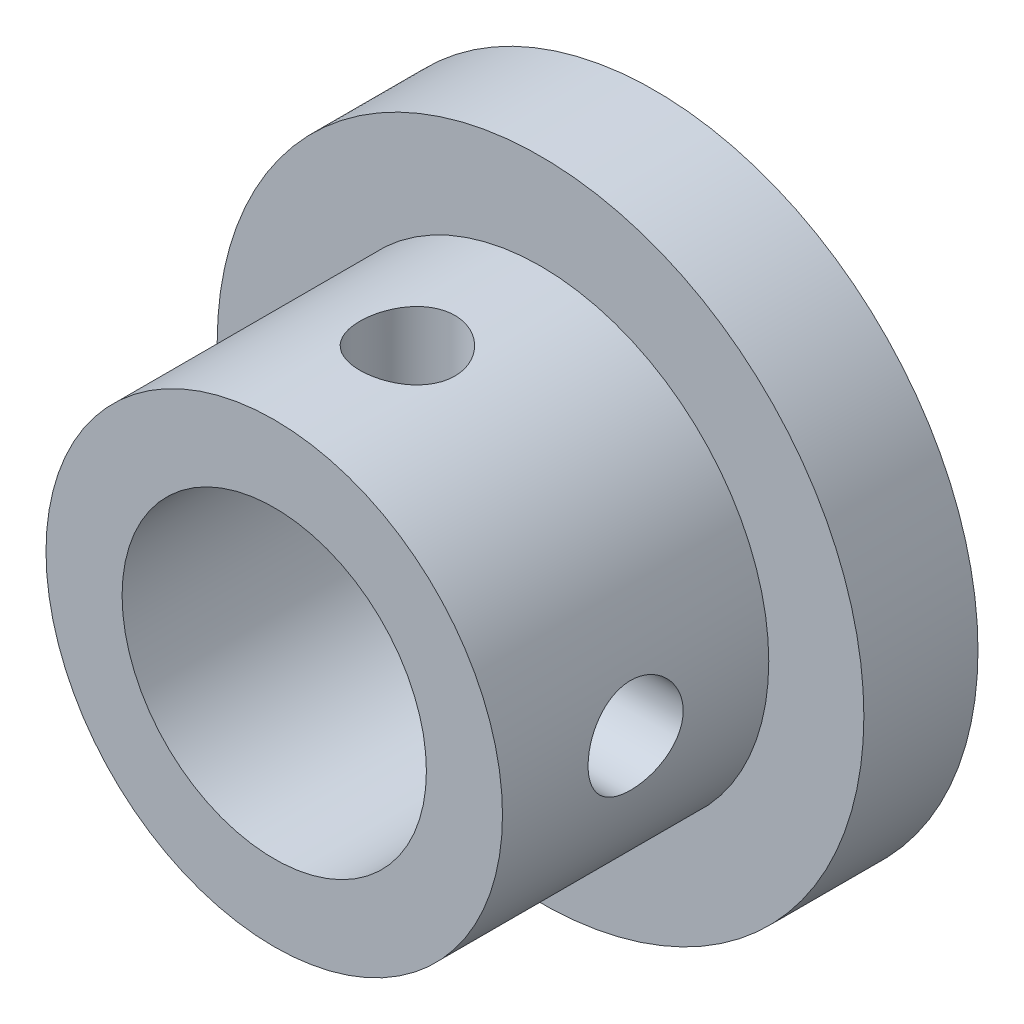
from build123d import *

# Parameters (mm, degrees)
SKETCH_1_R                       = 8.5
EXTRUDE_1_DEPTH                  = 3
SKETCH_2_R                       = 6
EXTRUDE_2_DEPTH                  = 7
CUT_EXTRUDE_1_REACH              = 17.636
SKETCH_3_R                       = 4
HOLE_WIZARD_M3_1_REACH           = 20.021
HOLE_WIZARD_M3_1_BORE_R          = 1.25
HOLE_WIZARD_M3_1_ON_FACE_2_REACH = 20.021
HOLE_WIZARD_M3_1_BORE_2_R        = 1.25


with BuildPart() as part:
    # 스케치1 → 보스-돌출1 (new body)
    with BuildSketch(Plane.XY):
        Circle(SKETCH_1_R)
    extrude(amount=EXTRUDE_1_DEPTH)

    # 스케치2 → 보스-돌출2 (add)
    with BuildSketch(Plane.XY.offset(3)):
        Circle(SKETCH_2_R)
    extrude(amount=EXTRUDE_2_DEPTH)

    # 스케치3 → 컷-돌출1 (cut, up to next)
    with BuildSketch(Plane(origin=(0, 0, 0), x_dir=(-1, 0, 0), z_dir=(0, 0, -1)), mode=Mode.PRIVATE) as cut_extrude_1_sk1:
        Circle(SKETCH_3_R)
    cut_extrude_1_tool1 = extrude(cut_extrude_1_sk1.sketch, amount=-CUT_EXTRUDE_1_REACH, mode=Mode.PRIVATE) & part.part
    add(cut_extrude_1_tool1.solids().sort_by_distance((0, 0, 0))[0], mode=Mode.SUBTRACT)

    # M3 나사 구멍1 bore (on position points) → M3 나사 구멍1 (cut, up to next)
    with BuildSketch(Plane(origin=(0, 6, 6.5), x_dir=(1, 0, 0), z_dir=(0, 1, 0)), mode=Mode.PRIVATE) as hole_wizard_m3_1_sk1:
        Circle(HOLE_WIZARD_M3_1_BORE_R)
    hole_wizard_m3_1_tool1 = extrude(hole_wizard_m3_1_sk1.sketch, amount=-HOLE_WIZARD_M3_1_REACH, mode=Mode.PRIVATE) & part.part
    add(hole_wizard_m3_1_tool1.solids().sort_by_distance((0, 6, 6.5))[0], mode=Mode.SUBTRACT)

    # M3 나사 구멍1 bore 2 (on position points) → M3 나사 구멍1 on face 2 (cut, up to next)
    with BuildSketch(Plane(origin=(6, 0, 6.5), x_dir=(0, 0, 1), z_dir=(1, 0, 0)), mode=Mode.PRIVATE) as hole_wizard_m3_1_on_face_2_sk1:
        Circle(HOLE_WIZARD_M3_1_BORE_2_R)
    hole_wizard_m3_1_on_face_2_tool1 = extrude(hole_wizard_m3_1_on_face_2_sk1.sketch, amount=-HOLE_WIZARD_M3_1_ON_FACE_2_REACH, mode=Mode.PRIVATE) & part.part
    add(hole_wizard_m3_1_on_face_2_tool1.solids().sort_by_distance((6, 0, 6.5))[0], mode=Mode.SUBTRACT)


solid = part.part
